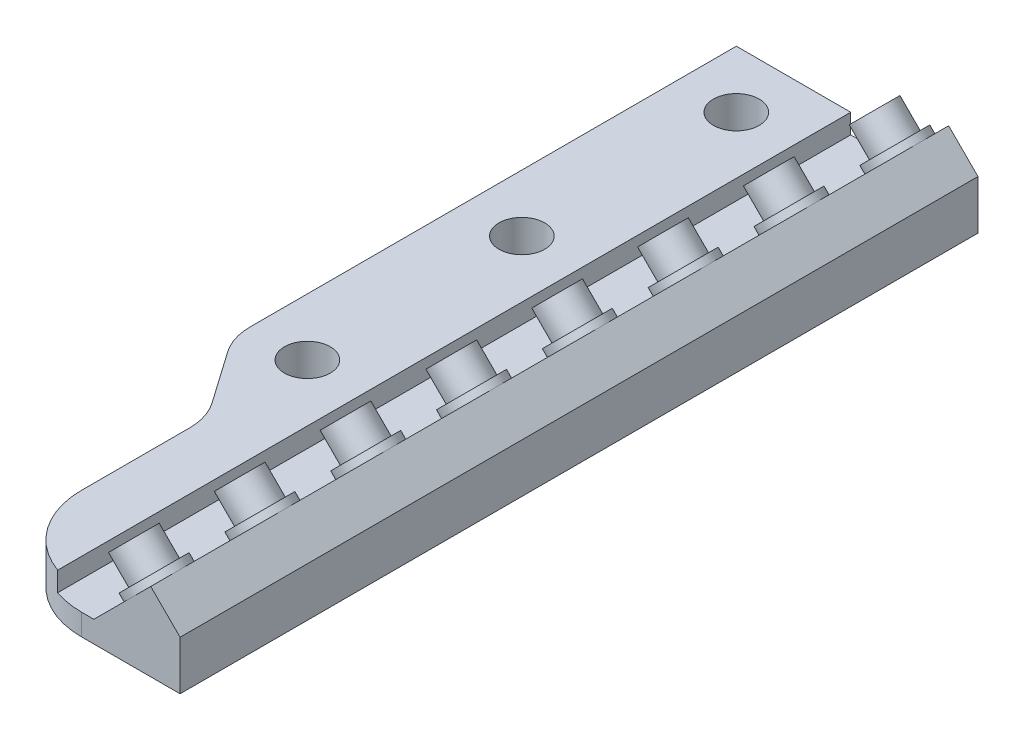
from build123d import *

# Parameters (mm, degrees)
EXTRUDE_1_DEPTH        = 63.5
SKETCH_2_R             = 1.45
EXTRUDE_2_DEPTH        = 2.5
SKETCH_3_R             = 2
EXTRUDE_3_DEPTH        = 0.5
PATTERN_LINEAR_1_COUNT = 9
PATTERN_LINEAR_1_PITCH = 7.4
SKETCH_4_R             = 1.6
CUT_EXTRUDE_1_DEPTH    = 10.5
PATTERN_LINEAR_2_COUNT = 3
PATTERN_LINEAR_2_PITCH = 15
CUT_EXTRUDE_2_DEPTH    = 5
FILLET_1_R             = 6
FILLET_2_R             = 4


with BuildPart() as part:
    # 草图1 → 凸台-拉伸1 (new body)
    with BuildSketch(Plane.XY):
        Polygon((16.9, 0), (16.9, 3.426641456), (14.8489809, 5.477660556), (14.495427509, 5.124107166), (12.374107166, 3.002786822), (10.871320344, 1.5), (8, 1.5), (8, 2.871320344), (0, 2.871320344), (0, 0), align=None)
    extrude(amount=EXTRUDE_1_DEPTH)

    # 草图2 → 凸台-拉伸2 (add)
    with BuildSketch(Plane(origin=(4.685660172, -4.685660172, 0), x_dir=(0, 0, 1), z_dir=(-0.7071067811865562, 0.7071067811865389, 0))):
        with Locations(Location((2, 12.373106012, 0), (0, 0, 90))):
            Circle(SKETCH_2_R)
    extrude_2 = extrude(amount=EXTRUDE_2_DEPTH)

    # 草图3 → 凸台-拉伸3 (add)
    with BuildSketch(Plane(origin=(4.685660172, -4.685660172, 0), x_dir=(0, 0, 1), z_dir=(-0.7071067811865562, 0.7071067811865389, 0))):
        with Locations(Location((2, 12.373106012, 0), (0, 0, 90))):
            Circle(SKETCH_3_R)
    extrude_3 = extrude(amount=EXTRUDE_3_DEPTH)

    # 阵列(线性)1: 凸台-拉伸2, 凸台-拉伸3 ×9
    with Locations(*[(0, 0, i * PATTERN_LINEAR_1_PITCH) for i in range(1, PATTERN_LINEAR_1_COUNT)]):
        add(extrude_2)
        add(extrude_3)

    # 草图4 → 切除-拉伸1 (cut)
    with BuildSketch(Plane(origin=(0, 2.871320344, 0), x_dir=(1, 0, 0), z_dir=(0, 1, 0))):
        with Locations(Location((4, -4, 0), (0, 0, 180))):
            Circle(SKETCH_4_R)
    cut_extrude_1 = extrude(amount=-CUT_EXTRUDE_1_DEPTH, mode=Mode.SUBTRACT)

    # 阵列(线性)2: 切除-拉伸1 ×3
    with Locations(*[(0, 0, i * PATTERN_LINEAR_2_PITCH) for i in range(1, PATTERN_LINEAR_2_COUNT)]):
        add(cut_extrude_1, mode=Mode.SUBTRACT)

    # 草图6 → 切除-拉伸2 (cut, symmetric)
    with BuildSketch(Plane(origin=(0, 2.871320344, 0), x_dir=(1, 0, 0), z_dir=(0, 1, 0))):
        with BuildLine():
            Line((4, -40.973787182), (0.723391823, -36.294305745))
            ThreePointArc((0.723391823, -36.294305745), (0.185132197, -35.202823198), (0, -34))
            Line((0, -34), (-4.848158237, -34))
            Line((-4.848158237, -34), (-4.848158237, -69.568318456))
            Line((-4.848158237, -69.568318456), (19.447072331, -69.568318456))
            Line((19.447072331, -69.568318456), (19.447072331, -55.8))
            Line((19.447072331, -55.8), (4, -55.8))
            Line((4, -55.8), (4, -40.973787182))
        make_face()
    extrude(amount=CUT_EXTRUDE_2_DEPTH, both=True, mode=Mode.SUBTRACT)

    # 圆角1
    fillet_1_edges = [part.edges().sort_by_distance(p)[0] for p in [
        (4, 1.435660172, 55.8),
    ]]
    fillet(fillet_1_edges, radius=FILLET_1_R)

    # 圆角2
    fillet_2_edges = [part.edges().sort_by_distance(p)[0] for p in [
        (4, 1.435660172, 40.973787182),
    ]]
    fillet(fillet_2_edges, radius=FILLET_2_R)


solid = part.part
